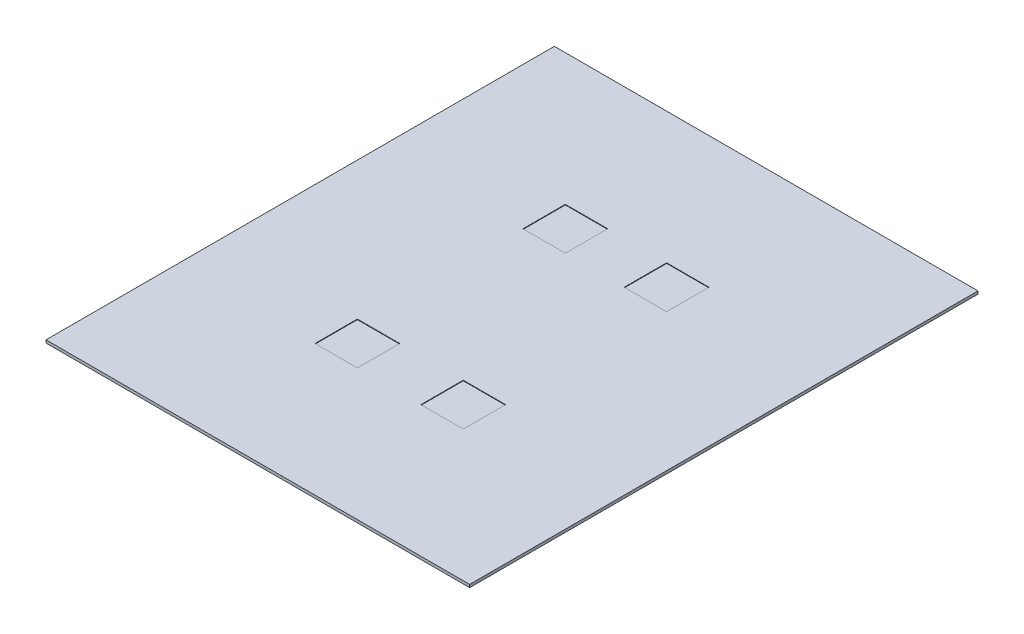
from build123d import *

# Parameters (mm, degrees)
SKETCH1_W           = 7500
SKETCH1_H           = 9000
BOSS_EXTRUDE1_DEPTH = 50
SKETCH2_W           = 750
SKETCH2_H           = 750
CUT_EXTRUDE1_DEPTH  = 10


with BuildPart() as part:
    # Sketch1 → Boss-Extrude1 (new body)
    with BuildSketch(Plane(origin=(0, 0, 0), x_dir=(1, 0, 0), z_dir=(0, 1, 0))):
        Rectangle(SKETCH1_W, SKETCH1_H)
    extrude(amount=BOSS_EXTRUDE1_DEPTH)

    # Sketch2 → Cut-Extrude1 (cut)
    with BuildSketch(Plane(origin=(0, 50, 0), x_dir=(1, 0, 0), z_dir=(0, 1, 0))):
        with Locations((-855.606548028, 1800)):
            Rectangle(SKETCH2_W, SKETCH2_H)
        with Locations((937.5, 1800)):
            Rectangle(SKETCH2_W, SKETCH2_H)
        with Locations((-937.5, -1800)):
            Rectangle(SKETCH2_W, SKETCH2_H)
        with Locations((937.5, -1800)):
            Rectangle(SKETCH2_W, SKETCH2_H)
    extrude(amount=-CUT_EXTRUDE1_DEPTH, mode=Mode.SUBTRACT)


solid = part.part
